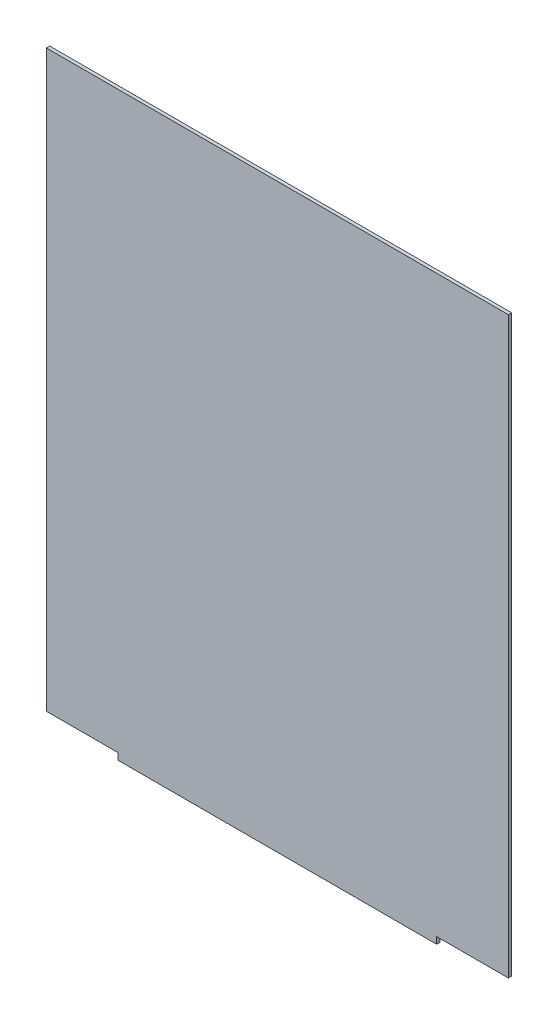
from build123d import *

# Parameters (mm, degrees)
SKETCH_1_W          = 419
SKETCH_1_H          = 527
EXTRUDE_1_DEPTH     = 3
SKETCH_3_W          = 65
SKETCH_3_H          = 6
CUT_EXTRUDE_5_DEPTH = 3


with BuildPart() as part:
    # Эскиз1 → Бобышка-Вытянуть1 (new body)
    with BuildSketch(Plane.XY):
        Rectangle(SKETCH_1_W, SKETCH_1_H)
    extrude(amount=EXTRUDE_1_DEPTH)

    # Эскиз3 → Вырез-Вытянуть5 (cut)
    with BuildSketch(Plane(origin=(0, 0, 3), x_dir=(-1, 0, 0), z_dir=(0, 0, -1))):
        with Locations((-177, -260.5)):
            Rectangle(SKETCH_3_W, SKETCH_3_H)
        with Locations((177, -260.5)):
            Rectangle(SKETCH_3_W, SKETCH_3_H)
    extrude(amount=CUT_EXTRUDE_5_DEPTH, mode=Mode.SUBTRACT)


solid = part.part
